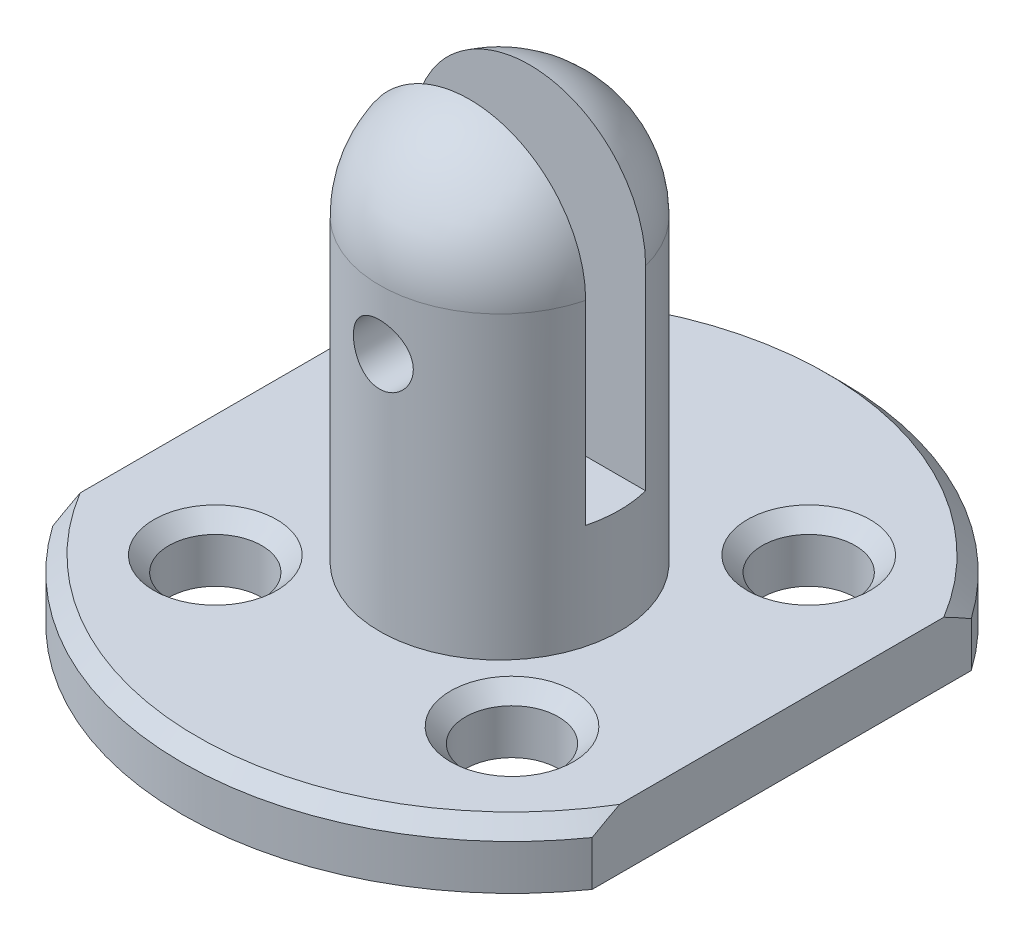
from build123d import *

# Parameters (mm, degrees)
BOSS_EXTRUDE1_DEPTH = 2
SKETCH3_R           = 1.55
CUT_EXTRUDE1_DEPTH  = 19.409437111
CHAMFER1_SIZE       = 0.5
SKETCH12_W          = 2
SKETCH12_H          = 13
CUT_EXTRUDE2_DEPTH  = 8
SKETCH13_R          = 1
CUT_EXTRUDE3_DEPTH  = 8
SKETCH14_R          = 3
BOSS_EXTRUDE2_DEPTH = 1


with BuildPart() as part:
    # Sketch2 → Boss-Extrude1 (new body)
    with BuildSketch(Plane(origin=(0, 0, 0), x_dir=(1, 0, 0), z_dir=(0, 1, 0))):
        with BuildLine():
            Line((-3.695276798, -5.910429472), (-3.695276798, 6.738681168))
            ThreePointArc((-3.695276798, 6.738681168), (5.304723202, 11.414125848), (14.304723202, 6.738681168))
            Line((14.304723202, 6.738681168), (14.304723202, -5.910429472))
            ThreePointArc((14.304723202, -5.910429472), (5.304723202, -10.585874152), (-3.695276798, -5.910429472))
        make_face()
    extrude(amount=BOSS_EXTRUDE1_DEPTH)

    # Sketch3 → Cut-Extrude1 (cut, through all)
    with BuildSketch(Plane(origin=(0, 2, 0), x_dir=(1, 0, 0), z_dir=(0, 1, 0))):
        with Locations(Location((10.25447067, 5.363873316, 0), (0, 0, 270))):
            Circle(SKETCH3_R)
        with Locations(Location((10.25447067, -4.53562162, 0), (0, 0, 270))):
            Circle(SKETCH3_R)
        with Locations(Location((0.354975733, -4.53562162, 0), (0, 0, 270))):
            Circle(SKETCH3_R)
        with Locations(Location((0.354975733, 5.363873316, 0), (0, 0, 270))):
            Circle(SKETCH3_R)
    extrude(amount=-CUT_EXTRUDE1_DEPTH, mode=Mode.SUBTRACT)

    # Chamfer1
    chamfer1_edges = [part.edges().sort_by_distance(p)[0] for p in [
        (5.304723202, 2, 10.585874152),
        (0.354975733, 2, -6.913873316),
        (0.354975733, 2, 2.98562162),
        (10.25447067, 2, 2.98562162),
        (10.25447067, 2, -6.913873316),
        (5.304723202, 2, -11.414125848),
    ]]
    chamfer(chamfer1_edges, length=CHAMFER1_SIZE)

    # Sketch4 → Revolve2 (revolve)
    with BuildSketch(Plane.XY, mode=Mode.PRIVATE) as revolve2_sk:
        with BuildLine():
            Line((5.304723202, 16), (5.304723202, 2))
            Line((5.304723202, 2), (9.304723202, 2))
            Line((9.304723202, 2), (9.304723202, 12))
            ThreePointArc((9.304723202, 12), (8.133150326, 14.828427125), (5.304723202, 16))
        make_face()
    revolve(revolve2_sk.sketch.rotate(Axis((5.304723202, 16, 0), (0, -1, 0)), 180), axis=Axis((5.304723202, 16, 0), (0, -1, 0)))

    # Sketch12 → Cut-Extrude2 (cut, symmetric)
    with BuildSketch(Plane(origin=(5.3, 0, 0), x_dir=(0, 0, -1), z_dir=(1, 0, 0))):
        with Locations((0, 12)):
            Rectangle(SKETCH12_W, SKETCH12_H)
    extrude(amount=CUT_EXTRUDE2_DEPTH, both=True, mode=Mode.SUBTRACT)

    # Sketch13 → Cut-Extrude3 (cut, symmetric)
    with BuildSketch(Plane.XY):
        with Locations((5.3, 10)):
            Circle(SKETCH13_R)
    extrude(amount=CUT_EXTRUDE3_DEPTH, both=True, mode=Mode.SUBTRACT)

    # Sketch14 → Boss-Extrude2 (add)
    with BuildSketch(Plane.XZ):
        with Locations(Location((5.304723202, -0.414125848, 0), (0, 0, 90))):
            Circle(SKETCH14_R)
    extrude(amount=BOSS_EXTRUDE2_DEPTH)


solid = part.part
